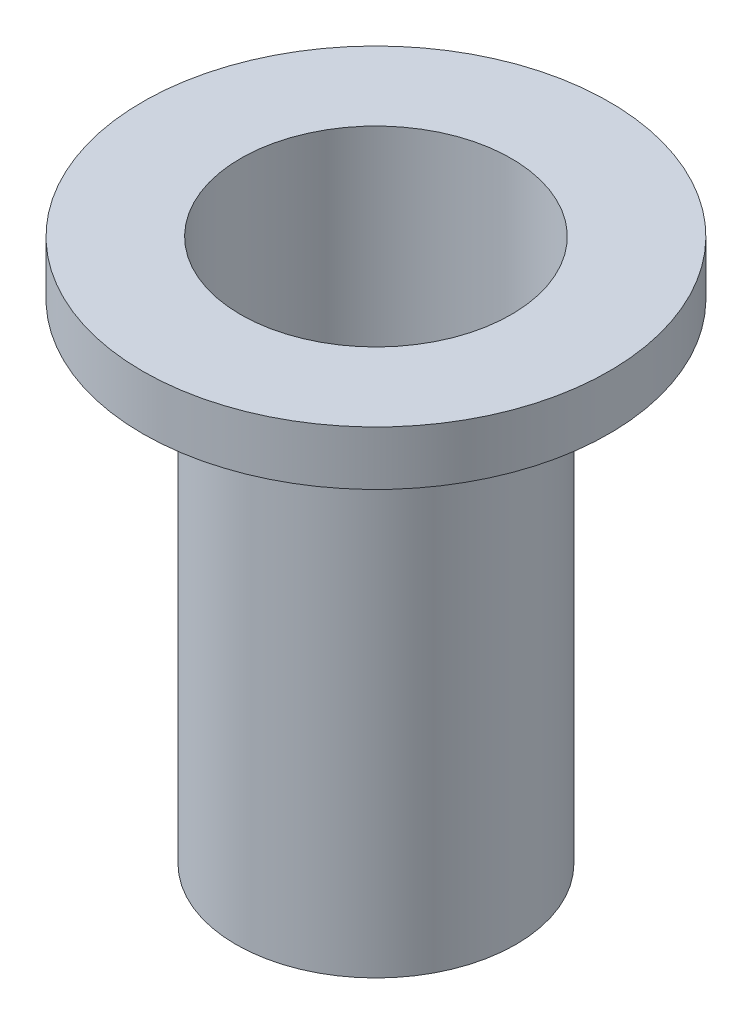
from build123d import *

# Parameters (mm, degrees)
SKETCH1_R           = 1.5
SKETCH1_R_2         = 1.45
BOSS_EXTRUDE1_DEPTH = 5.24
SKETCH4_R           = 2.5
SKETCH4_R_2         = 1.45
BOSS_EXTRUDE2_DEPTH = 0.58


with BuildPart() as part:
    # Sketch1 → Boss-Extrude1 (new body)
    with BuildSketch(Plane(origin=(0, 0, 0), x_dir=(1, 0, 0), z_dir=(0, 1, 0))):
        with Locations(Location((0, 0, 0), (0, 0, 270))):
            Circle(SKETCH1_R)
        with Locations(Location((0, 0, 0), (0, 0, 270))):
            Circle(SKETCH1_R_2, mode=Mode.SUBTRACT)
    extrude(amount=BOSS_EXTRUDE1_DEPTH)

    # Sketch4 → Boss-Extrude2 (add)
    with BuildSketch(Plane(origin=(0, 5.24, 0), x_dir=(1, 0, 0), z_dir=(0, 1, 0))):
        with Locations(Location((0, 0, 0), (0, 0, 270))):
            Circle(SKETCH4_R)
        with Locations(Location((0, 0, 0), (0, 0, 270))):
            Circle(SKETCH4_R_2, mode=Mode.SUBTRACT)
    extrude(amount=BOSS_EXTRUDE2_DEPTH)


solid = part.part
